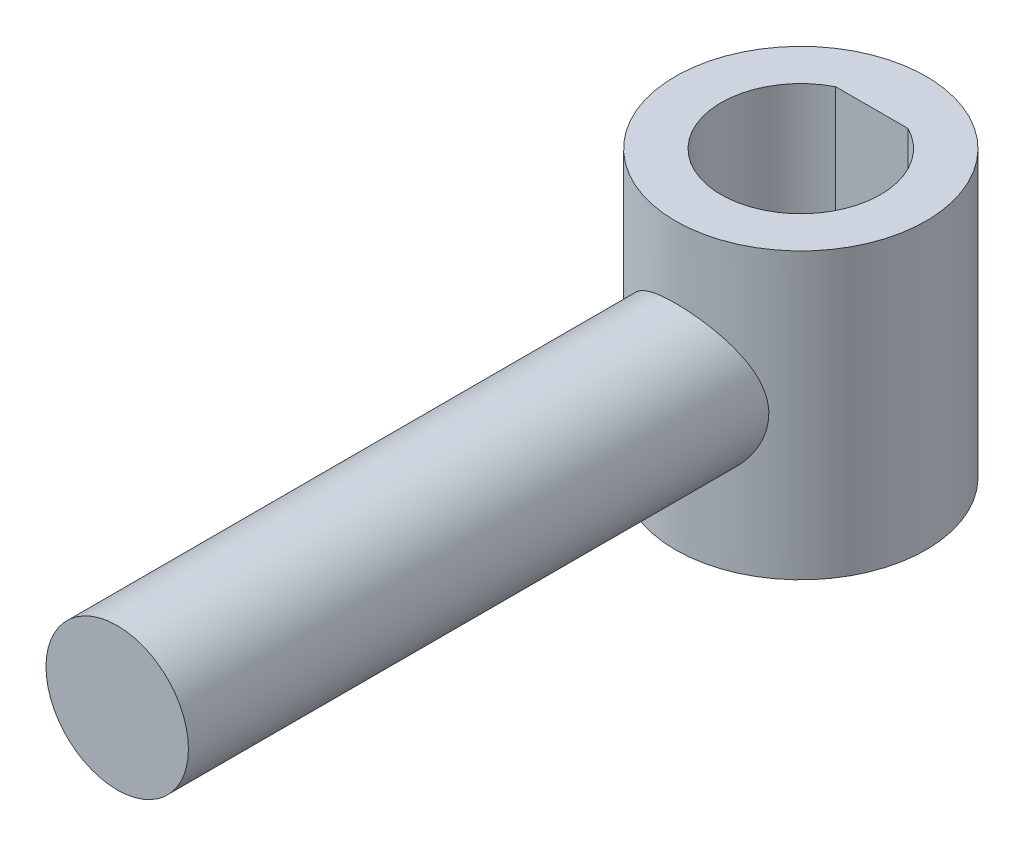
from build123d import *

# Parameters (mm, degrees)
SKETCH2_R               = 6.25
BOSS_EXTRUDE3_DEPTH     = 60
SKETCH1_R               = 11
BOSS_EXTRUDE4_DEPTH     = 12.5
CUT_EXTRUDE1_DEPTH      = 63.267567936
CUT_EXTRUDE1_DEPTH_BACK = 63.267567936
CUT_EXTRUDE2_DEPTH      = 2.35


with BuildPart() as part:
    # Sketch2 → Boss-Extrude3 (new body)
    with BuildSketch(Plane.XY):
        Circle(SKETCH2_R)
    extrude(amount=BOSS_EXTRUDE3_DEPTH)

    # Sketch1 → Boss-Extrude4 (add, symmetric)
    with BuildSketch(Plane(origin=(0, 0, 0), x_dir=(1, 0, 0), z_dir=(0, 1, 0))):
        Circle(SKETCH1_R)
    extrude(amount=BOSS_EXTRUDE4_DEPTH, both=True)

    # Sketch1<4> → Cut-Extrude1 (cut, two sides: drawn at the far end of the back side and taken through both)
    with BuildSketch(Plane(origin=(0, 0, 0), x_dir=(1, 0, 0), z_dir=(0, 1, 0)).offset(-CUT_EXTRUDE1_DEPTH_BACK)):
        with BuildLine():
            Line((3.175, 6.238539493), (-3.175, 6.238539493))
            ThreePointArc((-3.175, 6.238539493), (0, -7), (3.175, 6.238539493))
        make_face()
    extrude(amount=CUT_EXTRUDE1_DEPTH + CUT_EXTRUDE1_DEPTH_BACK, mode=Mode.SUBTRACT)

    # Sketch3 → Cut-Extrude2 (cut, symmetric)
    with BuildSketch(Plane.XY.offset(54)):
        with BuildLine():
            Line((-3.175, -5.38348168), (3.175, -5.38348168))
            ThreePointArc((3.175, -5.38348168), (0, -6.25), (-3.175, -5.38348168))
        make_face()
    extrude(amount=CUT_EXTRUDE2_DEPTH, both=True, mode=Mode.SUBTRACT)


solid = part.part
